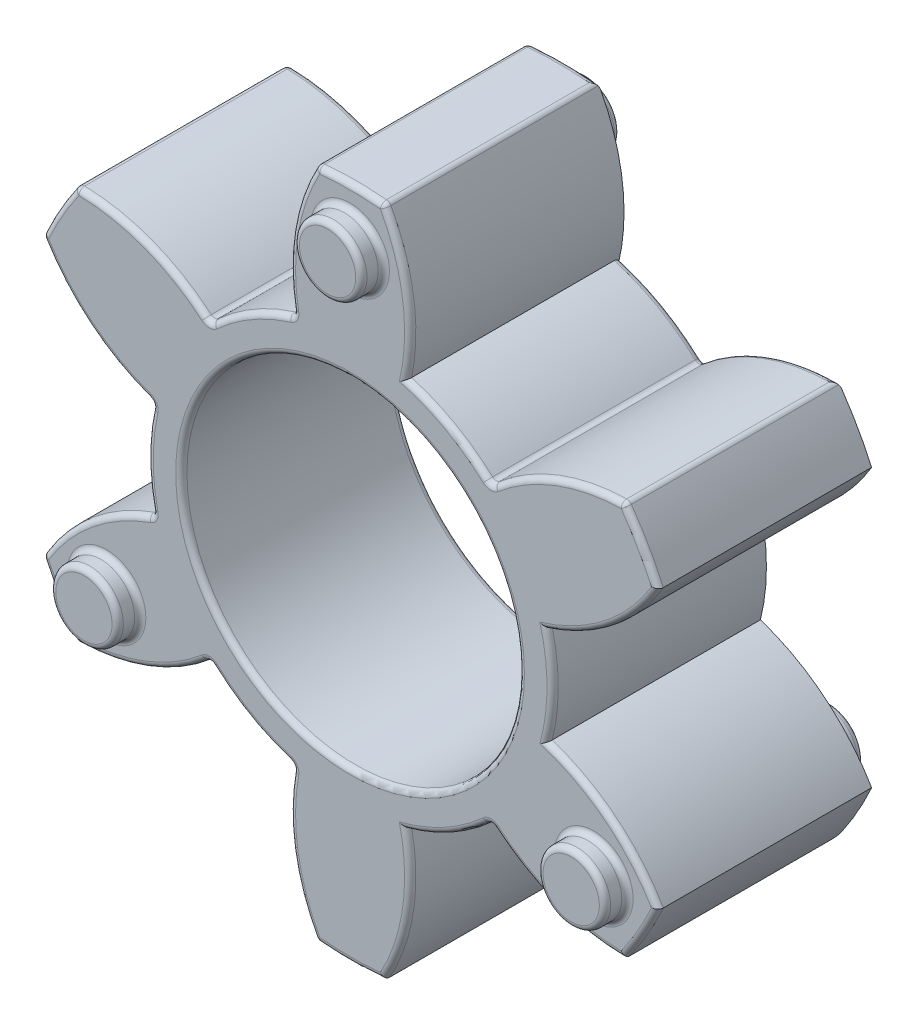
from build123d import *

# Parameters (mm, degrees)
SKETCH1_R           = 7.5
SKETCH1_R_2         = 1.5
BOSS_EXTRUDE2_DEPTH = 4.75
SKETCH1_2_R         = 1.5
BOSS_EXTRUDE3_DEPTH = 5.75
SKETCH1_3_R         = 1.5
BOSS_EXTRUDE4_DEPTH = 5.75
FILLET1_R           = 0.25


with BuildPart() as part:
    # Sketch1 → Boss-Extrude2 (new, symmetric)
    with BuildSketch(Plane.XY):
        with BuildLine():
            ThreePointArc((-8.733733627, 2.172992623), (-9, 0), (-8.733733627, -2.172992623))
            ThreePointArc((-8.733733627, -2.172992623), (-11.56821088, -3.717773836), (-13.675265955, -6.163367673))
            ThreePointArc((-13.675265955, -6.163367673), (-12.990381057, -7.5), (-12.175265955, -8.761443884))
            ThreePointArc((-12.175265955, -8.761443884), (-9.003792028, -8.15947758), (-6.248733627, -6.477138879))
            ThreePointArc((-6.248733627, -6.477138879), (-4.5, -7.794228634), (-2.485, -8.650131502))
            ThreePointArc((-2.485, -8.650131502), (-2.564418852, -11.877251417), (-1.5, -14.924811557))
            ThreePointArc((-1.5, -14.924811557), (0, -15), (1.5, -14.924811557))
            ThreePointArc((1.5, -14.924811557), (2.564418852, -11.877251417), (2.485, -8.650131502))
            ThreePointArc((2.485, -8.650131502), (4.5, -7.794228634), (6.248733627, -6.477138879))
            ThreePointArc((6.248733627, -6.477138879), (9.003792028, -8.15947758), (12.175265955, -8.761443884))
            ThreePointArc((12.175265955, -8.761443884), (12.990381057, -7.5), (13.675265955, -6.163367673))
            ThreePointArc((13.675265955, -6.163367673), (11.56821088, -3.717773836), (8.733733627, -2.172992623))
            ThreePointArc((8.733733627, -2.172992623), (9, 0), (8.733733627, 2.172992623))
            ThreePointArc((8.733733627, 2.172992623), (11.56821088, 3.717773836), (13.675265955, 6.163367673))
            ThreePointArc((13.675265955, 6.163367673), (12.990381057, 7.5), (12.175265955, 8.761443884))
            ThreePointArc((12.175265955, 8.761443884), (9.003792028, 8.15947758), (6.248733627, 6.477138879))
            ThreePointArc((6.248733627, 6.477138879), (4.5, 7.794228634), (2.485, 8.650131502))
            ThreePointArc((2.485, 8.650131502), (2.564418852, 11.877251417), (1.5, 14.924811557))
            ThreePointArc((1.5, 14.924811557), (0, 15), (-1.5, 14.924811557))
            ThreePointArc((-1.5, 14.924811557), (-2.564418852, 11.877251417), (-2.485, 8.650131502))
            ThreePointArc((-2.485, 8.650131502), (-4.5, 7.794228634), (-6.248733627, 6.477138879))
            ThreePointArc((-6.248733627, 6.477138879), (-9.003792028, 8.15947758), (-12.175265955, 8.761443884))
            ThreePointArc((-12.175265955, 8.761443884), (-12.990381057, 7.5), (-13.675265955, 6.163367673))
            ThreePointArc((-13.675265955, 6.163367673), (-11.56821088, 3.717773836), (-8.733733627, 2.172992623))
        make_face()
        Circle(SKETCH1_R, mode=Mode.SUBTRACT)
        with Locations((0, 12.5)):
            Circle(SKETCH1_R_2, mode=Mode.SUBTRACT)
        with Locations((10.825317547, -6.25)):
            Circle(SKETCH1_R_2, mode=Mode.SUBTRACT)
        with Locations((-10.825317547, -6.25)):
            Circle(SKETCH1_R_2, mode=Mode.SUBTRACT)
    extrude(amount=BOSS_EXTRUDE2_DEPTH, both=True)

    # Sketch1<2> → Boss-Extrude3 (add, symmetric)
    with BuildSketch(Plane.XY):
        with Locations((0, 12.5)):
            Circle(SKETCH1_2_R)
    extrude(amount=BOSS_EXTRUDE3_DEPTH, both=True)

    # Sketch1<3> → Boss-Extrude4 (add, symmetric)
    with BuildSketch(Plane.XY):
        with Locations((10.825317547, -6.25)):
            Circle(SKETCH1_3_R)
        with Locations((-10.825317547, -6.25)):
            Circle(SKETCH1_3_R)
    extrude(amount=BOSS_EXTRUDE4_DEPTH, both=True)

    # Fillet1
    fillet1_edges = [part.edges().sort_by_distance(p)[0] for p in [
        (-9.003792028, -8.15947758, -4.75),
        (4.5, -7.794228634, -4.75),
        (4.5, 7.794228634, -4.75),
        (-12.325317547, -6.25, -5.75),
        (-12.325317547, -6.25, 5.75),
        (-12.325317547, -6.25, -4.75),
        (9.325317547, -6.25, -5.75),
        (9.325317547, -6.25, 5.75),
        (9.325317547, -6.25, -4.75),
        (-1.5, 12.5, -5.75),
        (-1.5, 12.5, 5.75),
        (-1.5, 12.5, -4.75),
        (-12.325317547, -6.25, 4.75),
        (9.325317547, -6.25, 4.75),
        (-1.5, 12.5, 4.75),
        (-7.5, 0, -4.75),
        (-7.5, 0, 4.75),
        (-4.5, 7.794228634, -4.75),
        (-9.003792028, 8.15947758, -4.75),
        (-12.990381057, 7.5, -4.75),
        (-11.56821088, 3.717773836, -4.75),
        (-9, 0, -4.75),
        (-11.56821088, -3.717773836, -4.75),
        (-12.990381057, -7.5, -4.75),
        (-4.5, -7.794228634, -4.75),
        (-2.564418852, -11.877251417, -4.75),
        (9.003792028, -8.15947758, -4.75),
        (9.003792028, 8.15947758, -4.75),
        (0, 15, -4.75),
        (-2.564418852, 11.877251417, -4.75),
        (-4.5, 7.794228634, 4.75),
        (-9.003792028, 8.15947758, 4.75),
        (-12.990381057, 7.5, 4.75),
        (-11.56821088, 3.717773836, 4.75),
        (-9, 0, 4.75),
        (-11.56821088, -3.717773836, 4.75),
        (-12.990381057, -7.5, 4.75),
        (-9.003792028, -8.15947758, 4.75),
        (-4.5, -7.794228634, 4.75),
        (-2.564418852, -11.877251417, 4.75),
        (0, -15, 4.75),
        (2.564418852, -11.877251417, 4.75),
        (4.5, -7.794228634, 4.75),
        (9.003792028, -8.15947758, 4.75),
        (12.990381057, -7.5, 4.75),
        (11.56821088, -3.717773836, 4.75),
        (9, 0, 4.75),
        (11.56821088, 3.717773836, 4.75),
        (12.990381057, 7.5, 4.75),
        (9.003792028, 8.15947758, 4.75),
        (4.5, 7.794228634, 4.75),
        (2.564418852, 11.877251417, 4.75),
        (0, 15, 4.75),
        (-2.564418852, 11.877251417, 4.75),
        (-2.485, 8.650131502, 0),
        (-1.5, 14.924811557, 0),
        (1.5, 14.924811557, 0),
        (6.248733627, 6.477138879, 0),
        (12.175265955, 8.761443884, 0),
        (6.248733627, -6.477138879, 0),
        (-1.5, -14.924811557, 0),
        (-2.485, -8.650131502, 0),
        (-6.248733627, -6.477138879, 0),
        (-12.175265955, -8.761443884, 0),
        (-13.675265955, -6.163367673, 0),
        (-8.733733627, -2.172992623, 0),
        (-8.733733627, 2.172992623, 0),
        (-13.675265955, 6.163367673, 0),
        (-12.175265955, 8.761443884, 0),
        (-6.248733627, 6.477138879, 0),
    ]]
    fillet(fillet1_edges, radius=FILLET1_R)


solid = part.part
